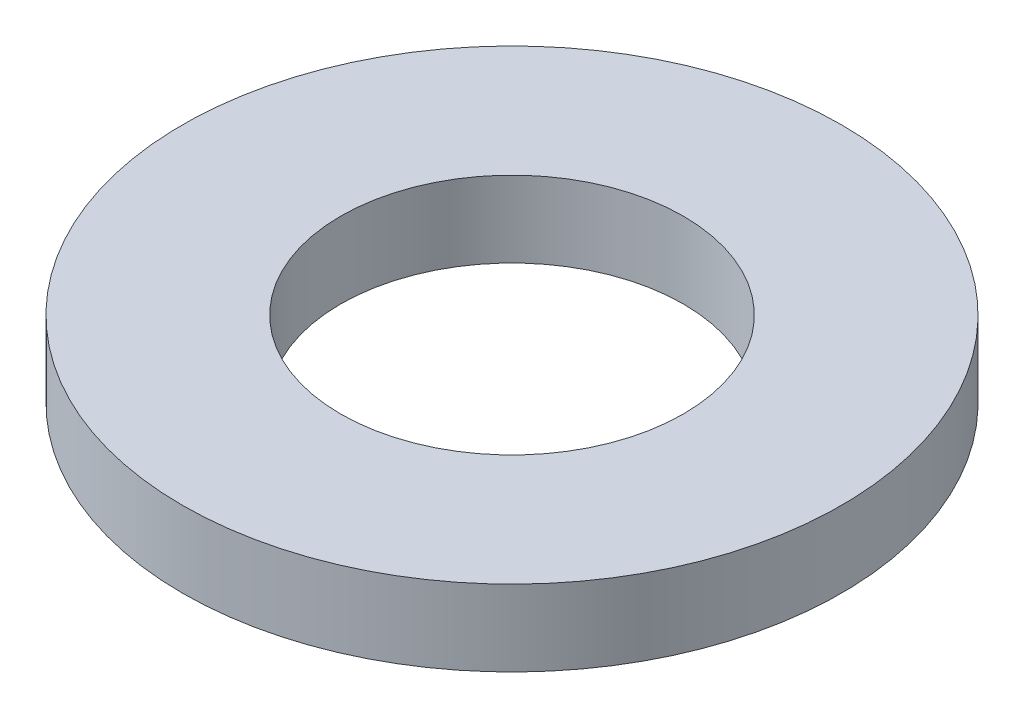
from build123d import *

# Parameters (mm, degrees)
SKETCH1_R           = 27.5
SKETCH1_R_2         = 14.3
BOSS_EXTRUDE1_DEPTH = 6.35


with BuildPart() as part:
    # Sketch1 → Boss-Extrude1 (new body)
    with BuildSketch(Plane(origin=(0, 0, 0), x_dir=(1, 0, 0), z_dir=(0, 1, 0))):
        with Locations(Location((0, 0, 0), (0, 0, 270))):
            Circle(SKETCH1_R)
        with Locations(Location((0, 0, 0), (0, 0, 270))):
            Circle(SKETCH1_R_2, mode=Mode.SUBTRACT)
    extrude(amount=BOSS_EXTRUDE1_DEPTH)


solid = part.part
